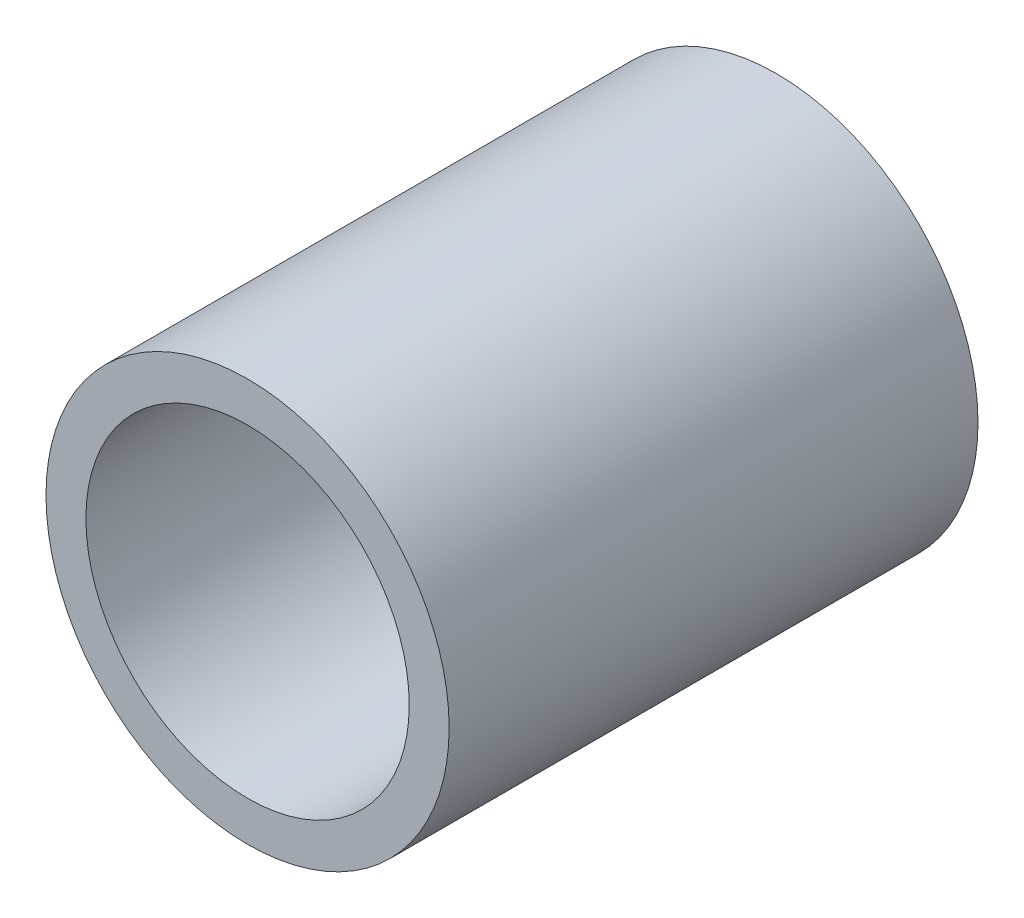
from build123d import *

# Parameters (mm, degrees)
SKETCH1_R           = 5.05
SKETCH1_R_2         = 4.05
EXTRUDE_THIN1_DEPTH = 13.25


with BuildPart() as part:
    # Sketch1 → Extrude-Thin1 (new body)
    with BuildSketch(Plane.XY):
        Circle(SKETCH1_R)
        Circle(SKETCH1_R_2, mode=Mode.SUBTRACT)
    extrude(amount=EXTRUDE_THIN1_DEPTH)


solid = part.part
